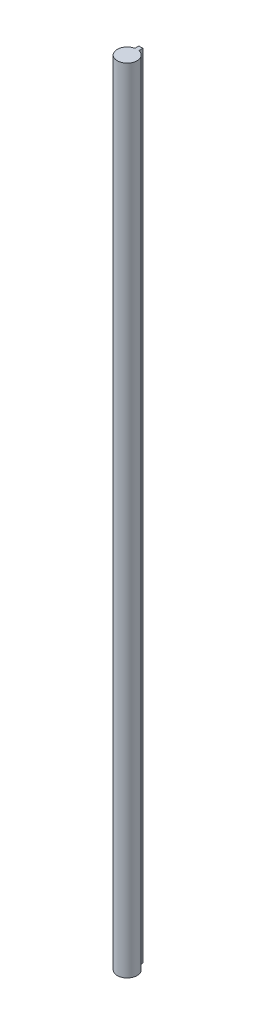
from build123d import *

# Parameters (mm, degrees)
EXTRUDE_1_DEPTH = 800


with BuildPart() as part:
    # 草图1 → 凸台-拉伸1 (new body)
    with BuildSketch(Plane(origin=(0, 0, 0), x_dir=(1, 0, 0), z_dir=(0, 1, 0))):
        with BuildLine():
            Line((-2, 9.797958971), (-2, 13.797958971))
            Line((-2, 13.797958971), (2, 13.797958971))
            Line((2, 13.797958971), (2, 9.797958971))
            ThreePointArc((2, 9.797958971), (0, -10), (-2, 9.797958971))
        make_face()
    extrude(amount=EXTRUDE_1_DEPTH)


solid = part.part
